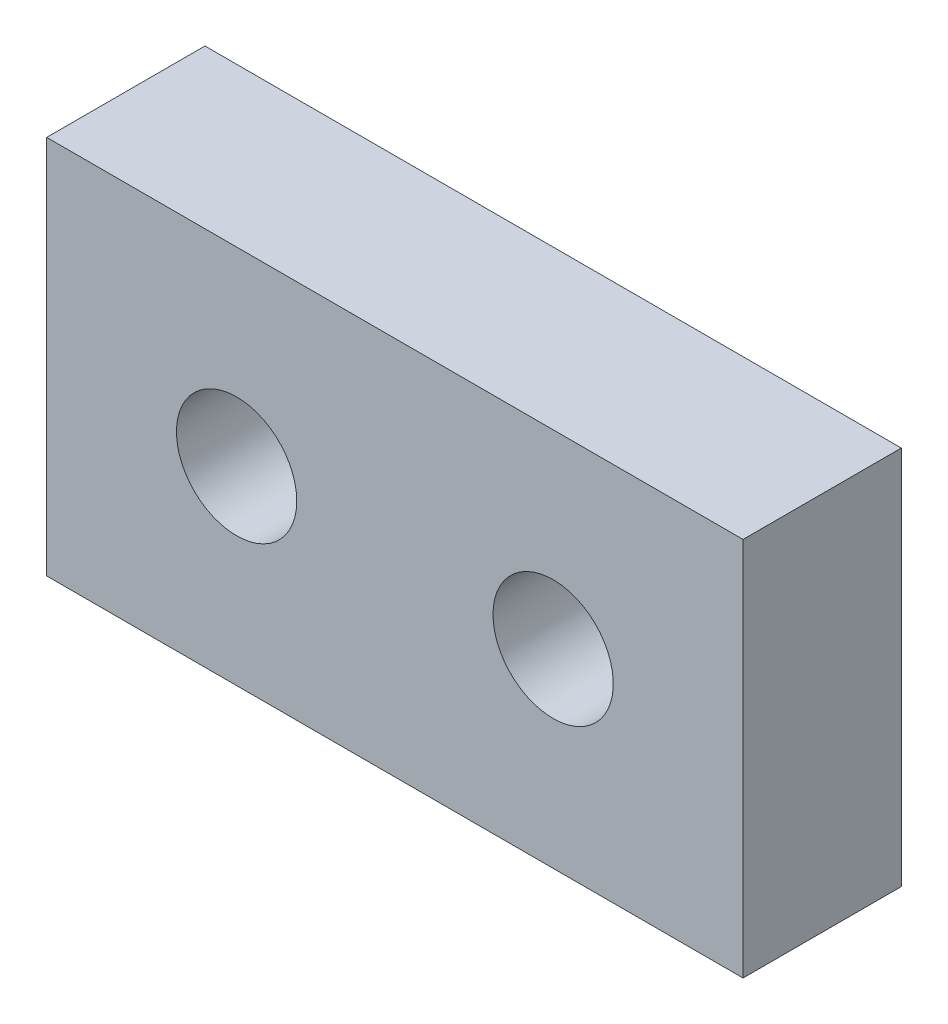
from build123d import *

# Parameters (mm, degrees)
SKETCH_1_W      = 22
SKETCH_1_H      = 12
SKETCH_1_R      = 1.9
EXTRUDE_1_DEPTH = 5


with BuildPart() as part:
    # 스케치1 → 보스-돌출1 (new body)
    with BuildSketch(Plane.XY):
        Rectangle(SKETCH_1_W, SKETCH_1_H)
        with Locations((-5, 0)):
            Circle(SKETCH_1_R, mode=Mode.SUBTRACT)
        with Locations(Location((5, 0, 0), (0, 0, 180))):
            Circle(SKETCH_1_R, mode=Mode.SUBTRACT)
    extrude(amount=EXTRUDE_1_DEPTH)


solid = part.part
